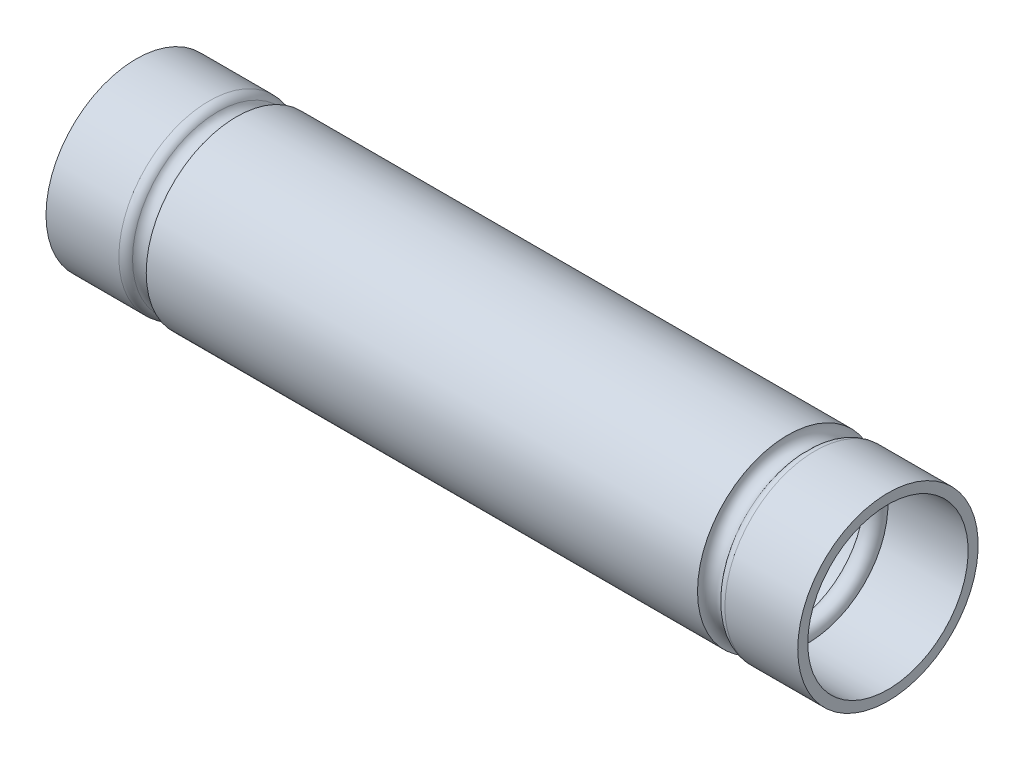
from build123d import *

# Parameters (mm, degrees)
FILLET1_R = 0.499997184


with BuildPart() as part:
    # Sketch1 → Revolve1 (revolve)
    with BuildSketch(Plane(origin=(0, 0, 0), x_dir=(-1, 0, 0), z_dir=(0, 0, -1)), mode=Mode.PRIVATE) as revolve1_sk:
        with BuildLine():
            Line((-4, 4), (0, 4))
            Line((0, 4), (0, 4.5))
            Line((0, 4.5), (-4, 4.5))
            ThreePointArc((-4, 4.5), (-4.5, 4), (-5, 4.5))
            Line((-5, 4.5), (-32.5, 4.5))
            ThreePointArc((-32.5, 4.5), (-33, 4), (-33.5, 4.5))
            Line((-33.5, 4.5), (-37.5, 4.5))
            Line((-37.5, 4.5), (-37.5, 4))
            Line((-37.5, 4), (-33.5, 4))
            ThreePointArc((-33.5, 4), (-33, 3.5), (-32.5, 4))
            Line((-32.5, 4), (-5, 4))
            ThreePointArc((-5, 4), (-4.5, 3.5), (-4, 4))
        make_face()
    revolve(revolve1_sk.sketch.rotate(Axis((37.5, 0, 0), (-1, 0, 0)), 270), axis=Axis((37.5, 0, 0), (-1, 0, 0)))

    # Fillet1
    fillet1_edges = [part.edges().sort_by_distance(p)[0] for p in [
        (33.5, 0, -4.5),
        (4, 0, -4.5),
    ]]
    fillet(fillet1_edges, radius=FILLET1_R)


solid = part.part
